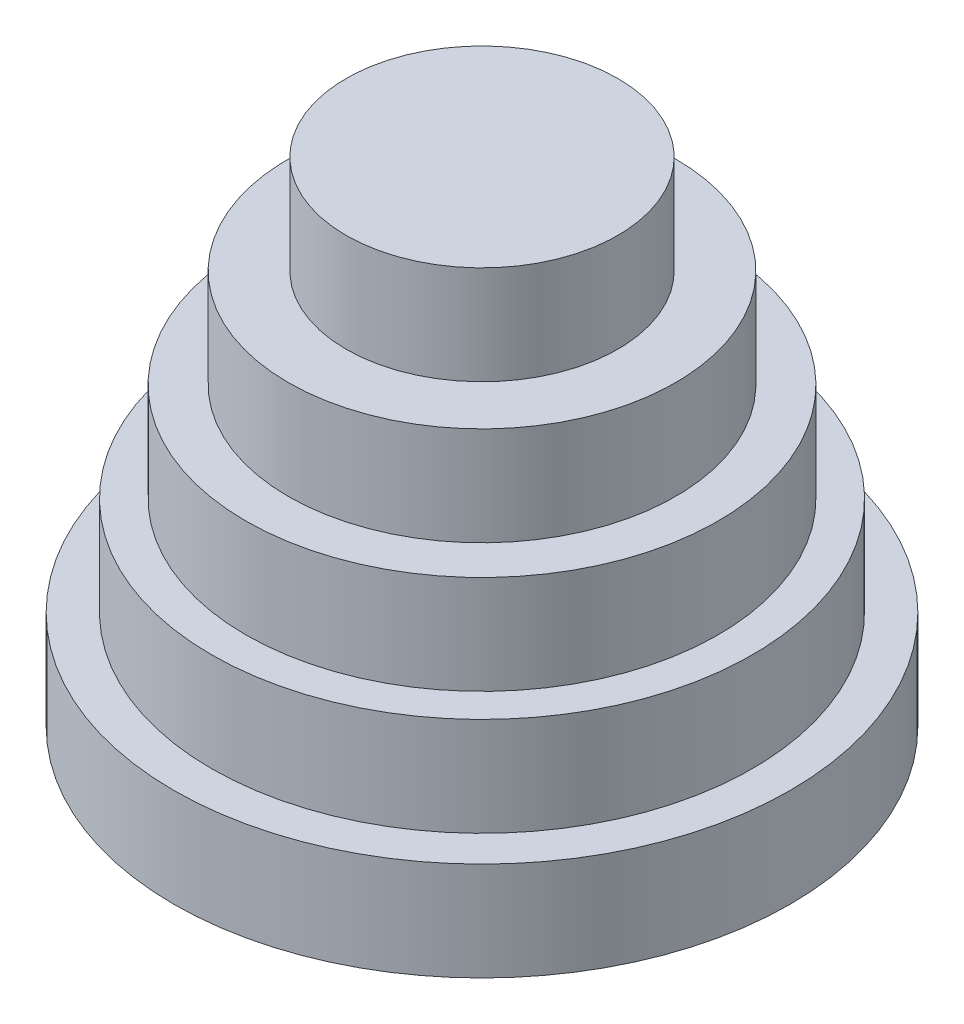
from build123d import *


with BuildPart() as part:
    # Sketch2 → Revolve1 (revolve)
    with BuildSketch(Plane.XY, mode=Mode.PRIVATE) as revolve1_sk:
        Polygon((0, 40), (0, 0), (-25, 0), (-25, 8), (-21.942176439, 8), (-21.942176439, 16), (-19.15417669, 16), (-19.15417669, 24), (-15.707750434, 24), (-15.707750434, 32), (-11.024374779, 32), (-11.024374779, 40), align=None)
    revolve(revolve1_sk.sketch.rotate(Axis((0, 40, 0), (0, -1, 0)), 270), axis=Axis((0, 40, 0), (0, -1, 0)))


solid = part.part
